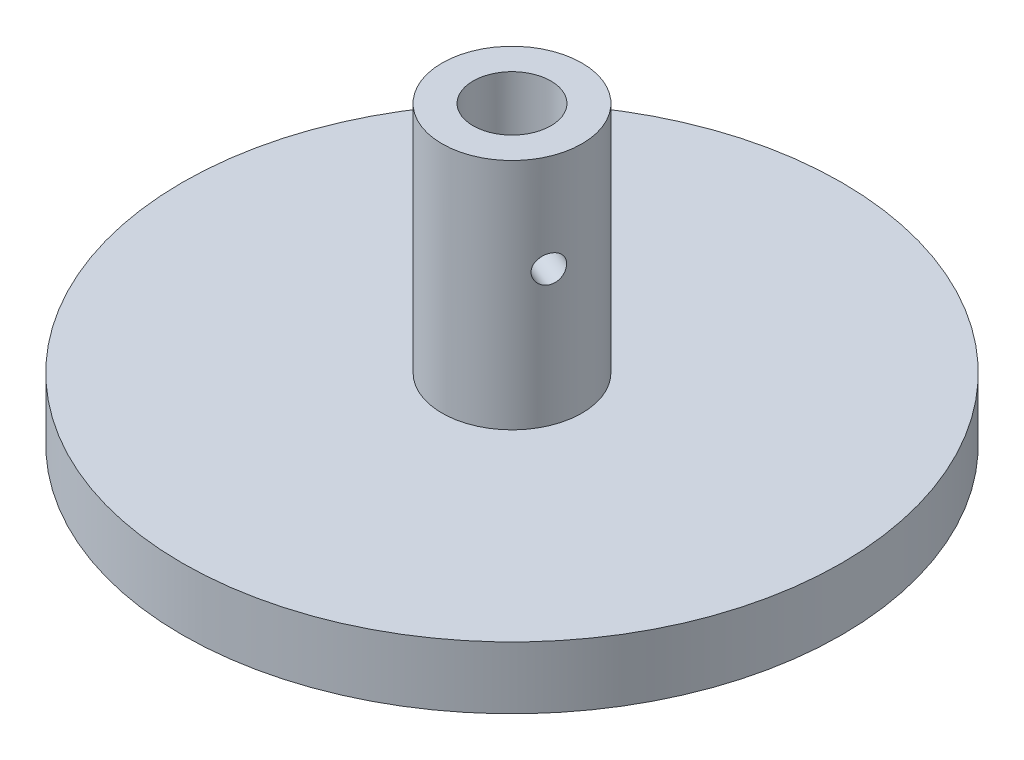
from build123d import *

# Parameters (mm, degrees)
CROQUIS1_R                       = 4.5
CROQUIS1_R_2                     = 2.5
SALIENTE_EXTRUIR1_DEPTH          = 15
CROQUIS2_R                       = 21.2
SALIENTE_EXTRUIR2_DEPTH          = 4
CROQUIS4_R                       = 2.5
CORTAR_EXTRUIR1_DEPTH            = 4
TALADRO_ROSCADO_M2_2X0_451_D     = 1.75
TALADRO_ROSCADO_M2_2X0_451_DEPTH = 31.5
TALADRO_ROSCADO_M2_2X0_451_TIP   = 0.525753042


with BuildPart() as part:
    # Croquis1 → Saliente-Extruir1 (new body)
    with BuildSketch(Plane(origin=(0, 0, 0), x_dir=(1, 0, 0), z_dir=(0, 1, 0))):
        with Locations(Location((-10.454412373, 0, 0), (0, 0, 270))):
            Circle(CROQUIS1_R)
        with Locations(Location((-10.454412373, 0, 0), (0, 0, 270))):
            Circle(CROQUIS1_R_2, mode=Mode.SUBTRACT)
    extrude(amount=SALIENTE_EXTRUIR1_DEPTH)

    # Croquis2 → Saliente-Extruir2 (add)
    with BuildSketch(Plane.XZ):
        with Locations(Location((-10.454412373, 0, 0), (0, 0, 270))):
            Circle(CROQUIS2_R)
    extrude(amount=SALIENTE_EXTRUIR2_DEPTH)

    # Croquis4 → Cortar-Extruir1 (cut)
    with BuildSketch(Plane.XZ.offset(4)):
        with Locations(Location((-10.454412373, 0, 0), (0, 0, 270))):
            Circle(CROQUIS4_R)
    extrude(amount=-CORTAR_EXTRUIR1_DEPTH, mode=Mode.SUBTRACT)

    # Taladro roscado M2.2x0.451
    with Locations(Plane(origin=(-14.605788229, 8.720753341, -1.73668607), x_dir=(0.385930237887, 0, -0.92252796786), z_dir=(-0.92252796786, 0, -0.385930237887))):
        with Locations((1e-09, 0)):
            Hole(TALADRO_ROSCADO_M2_2X0_451_D / 2, depth=TALADRO_ROSCADO_M2_2X0_451_DEPTH)
            with Locations((0, 0, -(TALADRO_ROSCADO_M2_2X0_451_DEPTH + TALADRO_ROSCADO_M2_2X0_451_TIP / 2))):  # 118° drill point
                Cone(0, TALADRO_ROSCADO_M2_2X0_451_D / 2, TALADRO_ROSCADO_M2_2X0_451_TIP, mode=Mode.SUBTRACT)


solid = part.part
